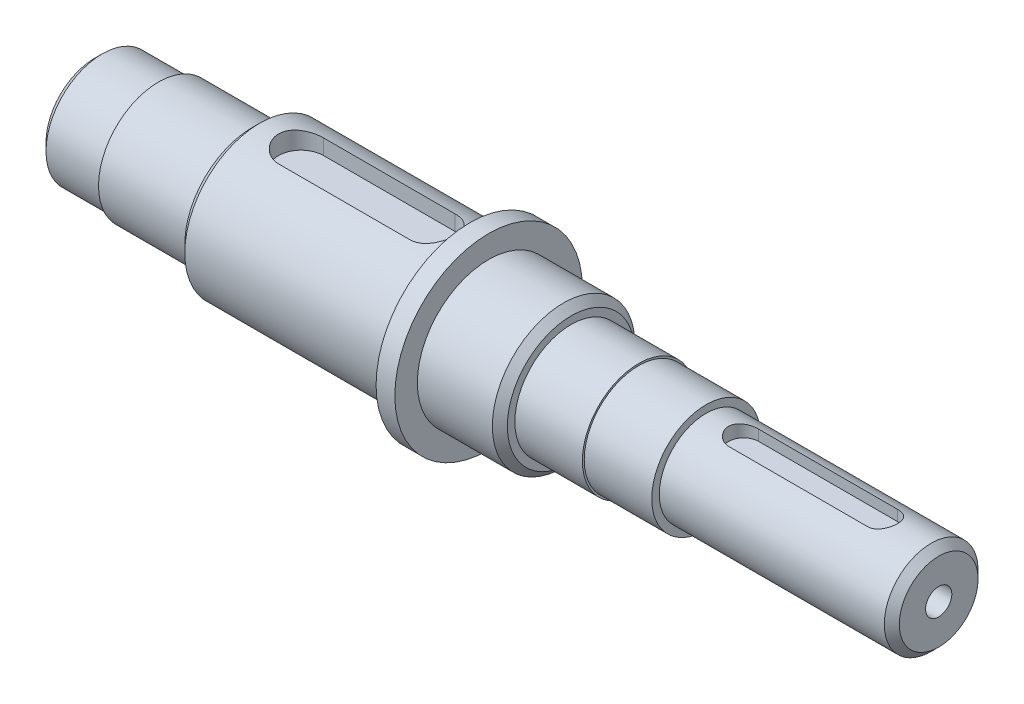
from build123d import *

# Parameters (mm, degrees)
PAH1_SIZE                   = 2
KES_EKSTR_ZYON1_START       = 15
KES_EKSTR_ZYON1_DEPTH       = 10
KES_EKSTR_ZYON2_START       = 9
KES_EKSTR_ZYON2_DEPTH       = 10
M8X1_0_DI_LI_DELIK1_D       = 7
M8X1_0_DI_LI_DELIK1_DEPTH   = 28
M8X1_0_DI_LI_DELIK1_TIP     = 2.103012167
M10X1_25_DI_LI_DELIK1_D     = 8.8
M10X1_25_DI_LI_DELIK1_DEPTH = 28.75
M10X1_25_DI_LI_DELIK1_TIP   = 2.643786724


with BuildPart() as part:
    # Çizim1 → Döndür1 (revolve)
    with BuildSketch(Plane(origin=(0, 0, 0), x_dir=(1, 0, 0), z_dir=(0, 0, -1)), mode=Mode.PRIVATE) as d_nd_r1_sk:
        Polygon((0, 0), (225, 0), (225, 12.5), (163, 12.5), (163, 14.5), (145, 14.5), (145, 15), (127, 15), (127, 19), (105, 19), (105, 25), (100, 25), (100, 20), (42, 20), (42, 16), (17, 16), (17, 15), (0, 15), align=None)
    revolve(d_nd_r1_sk.sketch.rotate(Axis((0, 0, 0), (1, 0, 0)), 270), axis=Axis((0, 0, 0), (1, 0, 0)))

    # Pah1
    pah1_edges = [part.edges().sort_by_distance(p)[0] for p in [
        (225, 0, -12.5),
        (127, 0, -19),
        (42, 0, -20),
        (0, 0, -15),
    ]]
    chamfer(pah1_edges, length=PAH1_SIZE)

    # Çizim2 → Kes-Ekstrüzyon1 (cut)
    with BuildSketch(Plane(origin=(0, 0, 0), x_dir=(1, 0, 0), z_dir=(0, 1, 0)).offset(KES_EKSTR_ZYON1_START)):
        with BuildLine():
            Line((55, 6), (90, 6))
            ThreePointArc((90, 6), (96, 0), (90, -6))
            Line((90, -6), (55, -6))
            ThreePointArc((55, -6), (49, 0), (55, 6))
        make_face()
    extrude(amount=KES_EKSTR_ZYON1_DEPTH, mode=Mode.SUBTRACT)

    # Çizim3 → Kes-Ekstrüzyon2 (cut)
    with BuildSketch(Plane(origin=(0, 0, 0), x_dir=(1, 0, 0), z_dir=(0, 1, 0)).offset(KES_EKSTR_ZYON2_START)):
        with BuildLine():
            Line((173, 4), (210, 4))
            ThreePointArc((210, 4), (214, 0), (210, -4))
            Line((210, -4), (173, -4))
            ThreePointArc((173, -4), (169, 0), (173, 4))
        make_face()
    extrude(amount=KES_EKSTR_ZYON2_DEPTH, mode=Mode.SUBTRACT)

    # M8x1.0 Dişli Delik1
    with Locations(Plane(origin=(225, 0, 0), x_dir=(0, 0, -1), z_dir=(1, 0, 0))):
        with Locations((0, 0)):
            Hole(M8X1_0_DI_LI_DELIK1_D / 2, depth=M8X1_0_DI_LI_DELIK1_DEPTH)
            with Locations((0, 0, -(M8X1_0_DI_LI_DELIK1_DEPTH + M8X1_0_DI_LI_DELIK1_TIP / 2))):  # 118° drill point
                Cone(0, M8X1_0_DI_LI_DELIK1_D / 2, M8X1_0_DI_LI_DELIK1_TIP, mode=Mode.SUBTRACT)

    # M10x1.25 Dişli Delik1
    with Locations(Plane.ZY):
        with Locations((0, 0)):
            Hole(M10X1_25_DI_LI_DELIK1_D / 2, depth=M10X1_25_DI_LI_DELIK1_DEPTH)
            with Locations((0, 0, -(M10X1_25_DI_LI_DELIK1_DEPTH + M10X1_25_DI_LI_DELIK1_TIP / 2))):  # 118° drill point
                Cone(0, M10X1_25_DI_LI_DELIK1_D / 2, M10X1_25_DI_LI_DELIK1_TIP, mode=Mode.SUBTRACT)


solid = part.part
